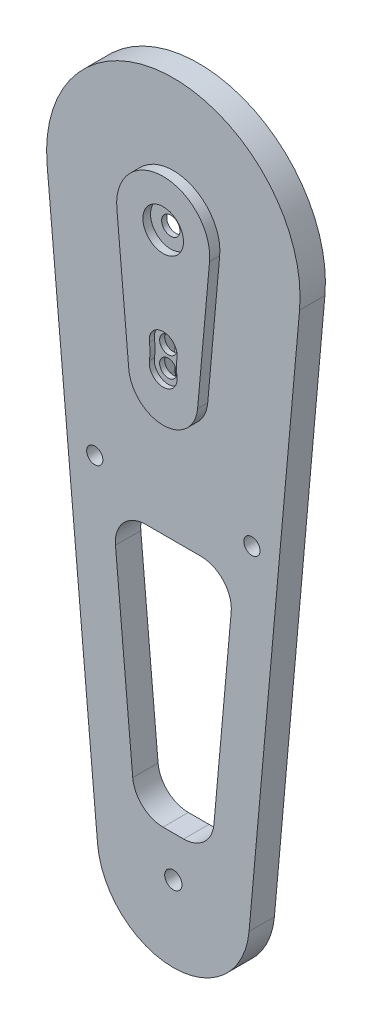
from build123d import *

# Parameters (mm, degrees)
CROQUIS1_R                                           = 1.7
SALIENTE_EXTRUIR1_DEPTH                              = 5
CROQUIS11_R                                          = 1.6
CORTAR_EXTRUIR1_DEPTH                                = 6
CORTAR_EXTRUIR2_REACH                                = 141.352
CROQUIS13_R                                          = 1.8
SALIENTE_EXTRUIR2_DEPTH                              = 2
SALIENTE_EXTRUIR3_START                              = -0.5
CROQUIS13_3_R                                        = 4
CROQUIS13_3_R_2                                      = 1.8
SALIENTE_EXTRUIR3_DEPTH                              = 0.5
CORTAR_EXTRUIR3_START                                = -1.5
CROQUIS14_R                                          = 4
CORTAR_EXTRUIR3_DEPTH                                = 1.5
CHAFL_N1_SIZE                                        = 1
REFRENTADO_PARA_TORNILLO_CON_CABEZA_TRON_D           = 3.4
REFRENTADO_PARA_TORNILLO_CON_CABEZA_TRON_CBORE_D     = 5.5
REFRENTADO_PARA_TORNILLO_CON_CABEZA_TRON_CBORE_DEPTH = 1
REDONDEO1_R                                          = 10
REDONDEO2_R                                          = 6


with BuildPart() as part:
    # Croquis1 → Saliente-Extruir1 (new body)
    with BuildSketch(Plane.XY):
        with BuildLine():
            Line((-24.90015137, 109.767857143), (-14.940090822, -1.339285714))
            ThreePointArc((-14.940090822, -1.339285714), (0, -15), (14.940090822, -1.339285714))
            Line((14.940090822, -1.339285714), (24.90015137, 109.767857143))
            ThreePointArc((24.90015137, 109.767857143), (0, 137), (-24.90015137, 109.767857143))
        make_face()
        Circle(CROQUIS1_R, mode=Mode.SUBTRACT)
        with BuildLine():
            ThreePointArc((0, 79.505), (-2.580939751, 80.574060249), (-3.65, 83.155))
            Line((-3.65, 83.155), (-3.65, 101.040870244))
            ThreePointArc((-3.65, 101.040870244), (-4.216609288, 104.359173979), (-5.852227935, 107.30144137))
            ThreePointArc((-5.852227935, 107.30144137), (-6.655195316, 115.468919185), (0.5, 119.488325914))
            ThreePointArc((0.5, 119.488325914), (5.480762949, 117.127013019), (7.505, 112))
            ThreePointArc((7.505, 112), (7.079759729, 109.509613047), (5.852227935, 107.30144137))
            ThreePointArc((5.852227935, 107.30144137), (4.216609288, 104.359173979), (3.65, 101.040870244))
            Line((3.65, 101.040870244), (3.65, 83.155))
            ThreePointArc((3.65, 83.155), (2.580939751, 80.574060249), (0, 79.505))
        make_face(mode=Mode.SUBTRACT)
    extrude(amount=SALIENTE_EXTRUIR1_DEPTH)

    # Croquis11 → Cortar-Extruir1 (cut)
    with BuildSketch(Plane(origin=(0, 0, 0), x_dir=(-1, 0, 0), z_dir=(0, 0, -1))):
        with Locations((-15.5, 64.768083746)):
            Circle(CROQUIS11_R)
        with Locations(Location((15.5, 64.768083746, 0), (0, 0, 180))):
            Circle(CROQUIS11_R)
    extrude(amount=-CORTAR_EXTRUIR1_DEPTH, mode=Mode.SUBTRACT)

    # Croquis12 → Cortar-Extruir2 (cut, up to next)
    with BuildSketch(Plane.XY.offset(5), mode=Mode.PRIVATE) as cortar_extruir2_sk1:
        Polygon((-12, 58), (12, 58), (7.517812675, 8), (-7.517812675, 8), align=None)
    cortar_extruir2_tool1 = extrude(cortar_extruir2_sk1.sketch, amount=-CORTAR_EXTRUIR2_REACH, mode=Mode.PRIVATE) & part.part
    add(cortar_extruir2_tool1.solids().sort_by_distance((0, 34.913717, 5))[0], mode=Mode.SUBTRACT)

    # Croquis13 → Saliente-Extruir2 (add)
    with BuildSketch(Plane.XY.offset(5)):
        with BuildLine():
            Line((6.784704059, 84.864496193), (9.143753072, 111.180319718))
            ThreePointArc((9.143753072, 111.180319718), (0, 121.180419163), (-9.143753072, 111.180319718))
            Line((-9.143753072, 111.180319718), (-6.784704059, 84.864496193))
            ThreePointArc((-6.784704059, 84.864496193), (0, 78.660792028), (6.784704059, 84.864496193))
        make_face()
        with Locations((0, 112)):
            Circle(CROQUIS13_R, mode=Mode.SUBTRACT)
    extrude(amount=SALIENTE_EXTRUIR2_DEPTH)

    # Croquis13<3> → Saliente-Extruir3 (add)
    with BuildSketch(Plane.XY.offset(5).offset(SALIENTE_EXTRUIR3_START)):
        with Locations((0, 112)):
            Circle(CROQUIS13_3_R)
        with Locations((0, 112)):
            Circle(CROQUIS13_3_R_2, mode=Mode.SUBTRACT)
    extrude(amount=SALIENTE_EXTRUIR3_DEPTH)

    # Croquis14 → Cortar-Extruir3 (cut)
    with BuildSketch(Plane.XY.offset(7).offset(CORTAR_EXTRUIR3_START)):
        with Locations((0, 112)):
            Circle(CROQUIS14_R)
    extrude(amount=CORTAR_EXTRUIR3_DEPTH, mode=Mode.SUBTRACT)

    # Chaflán1
    chafl_n1_edges = [part.edges().sort_by_distance(p)[0] for p in [
        (3.65, 92.097935122, 0),
        (4.216609288, 104.359173979, 0),
        (-2.490386953, 119.079759729, 0),
        (-4.216609288, 104.359173979, 0),
        (-3.65, 92.097935122, 0),
        (0, 79.505, 0),
    ]]
    chamfer(chafl_n1_edges, length=CHAFL_N1_SIZE)

    # Refrentado para tornillo con cabeza troncocónica de M31 (through all)
    with Locations(Plane(origin=(0, 0, 7), x_dir=(-1, 0, 0), z_dir=(0, 0, 1))):
        with Locations((0, -91.915), (0, -87.915)):
            CounterBoreHole(REFRENTADO_PARA_TORNILLO_CON_CABEZA_TRON_D / 2, REFRENTADO_PARA_TORNILLO_CON_CABEZA_TRON_CBORE_D / 2, REFRENTADO_PARA_TORNILLO_CON_CABEZA_TRON_CBORE_DEPTH)

    # Redondeo1
    redondeo1_edges = [part.edges().sort_by_distance(p)[0] for p in [
        (-1.887458609, 89.915, 6.5),
        (1.887458609, 89.915, 6.5),
    ]]
    fillet(redondeo1_edges, radius=REDONDEO1_R)

    # Redondeo2
    redondeo2_edges = [part.edges().sort_by_distance(p)[0] for p in [
        (7.517812675, 8, 2.5),
        (-7.517812675, 8, 2.5),
        (-12, 58, 2.5),
        (12, 58, 2.5),
    ]]
    fillet(redondeo2_edges, radius=REDONDEO2_R)


solid = part.part
